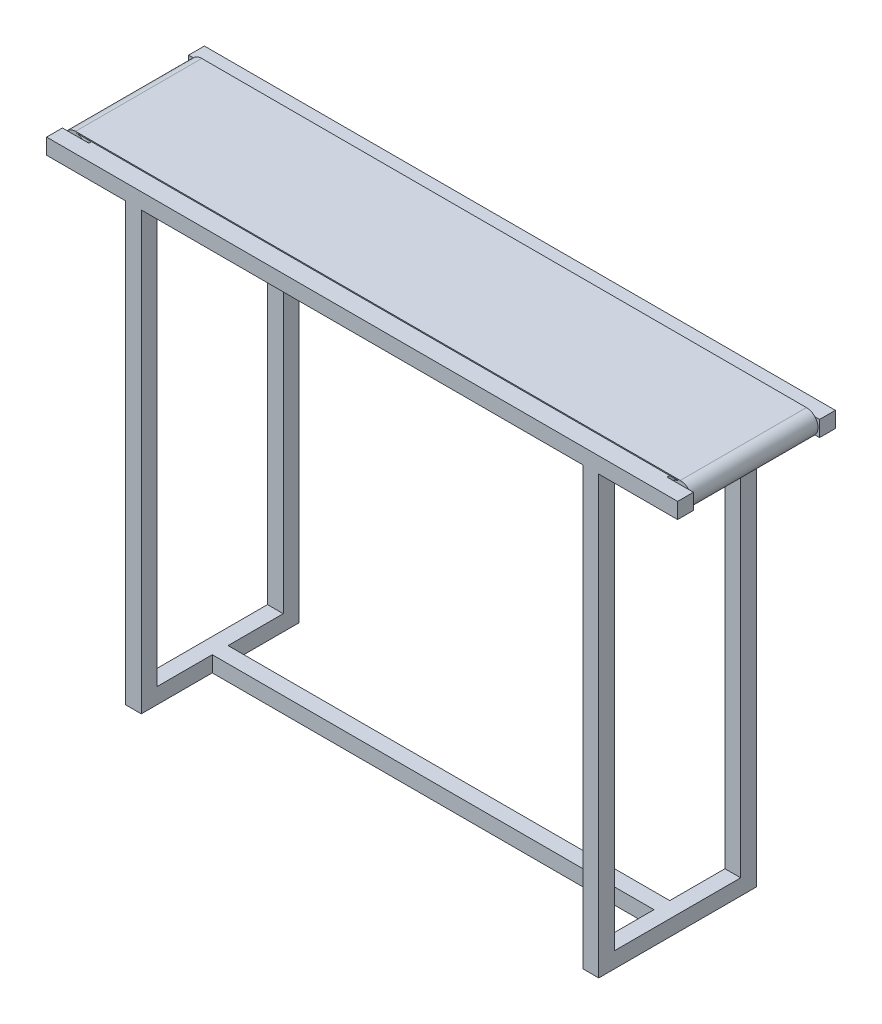
from build123d import *

# Parameters (mm, degrees)
BOSS_EXTRUDE1_DEPTH  = 30
SKETCH2_W            = 30
SKETCH2_H            = 300
BOSS_EXTRUDE2_DEPTH  = 30
SKETCH3_W            = 30
SKETCH3_H            = 30
BOSS_EXTRUDE3_DEPTH  = 800
SKETCH4_W            = 1200
SKETCH4_H            = 30
BOSS_EXTRUDE4_DEPTH  = 30
BOSS_EXTRUDE5_REACH  = 1367.394
SKETCH5_W            = 1100
SKETCH5_H            = 30
BOSS_EXTRUDE6_REACH  = 1350.814
SKETCH6_W            = 30
SKETCH6_H            = 30
SKETCH7_R            = 20
BOSS_EXTRUDE9_DEPTH  = 240
BOSS_EXTRUDE10_START = -240
BOSS_EXTRUDE10_DEPTH = 240
SKETCH9_R            = 6
CUT_EXTRUDE1_DEPTH   = 100


with BuildPart() as part:
    # Sketch1 → Boss-Extrude1 (new body)
    with BuildSketch(Plane.XY):
        Polygon((0, 0), (0, 800), (-150, 800), (-150, 830), (1050, 830), (1050, 800), (900, 800), (900, 0), (870, 0), (870, 800), (30, 800), (30, 0), align=None)
    extrude(amount=BOSS_EXTRUDE1_DEPTH)

    # Sketch2 → Boss-Extrude2 (add)
    with BuildSketch(Plane.XZ):
        with Locations((15, 150)):
            Rectangle(SKETCH2_W, SKETCH2_H)
        with Locations((885, 150)):
            Rectangle(SKETCH2_W, SKETCH2_H)
    extrude(amount=BOSS_EXTRUDE2_DEPTH)

    # Sketch3 → Boss-Extrude3 (add)
    with BuildSketch(Plane(origin=(0, 0, 0), x_dir=(1, 0, 0), z_dir=(0, 1, 0))):
        with Locations((15, -285)):
            Rectangle(SKETCH3_W, SKETCH3_H)
        with Locations((885, -285)):
            Rectangle(SKETCH3_W, SKETCH3_H)
    extrude(amount=BOSS_EXTRUDE3_DEPTH)

    # Sketch4 → Boss-Extrude4 (add)
    with BuildSketch(Plane(origin=(0, 800, 0), x_dir=(1, 0, 0), z_dir=(0, 1, 0))):
        with Locations((450, -285)):
            Rectangle(SKETCH4_W, SKETCH4_H)
    extrude(amount=BOSS_EXTRUDE4_DEPTH)

    # Sketch5 → Boss-Extrude5 (add, up to next)
    with BuildSketch(Plane.XY.offset(30), mode=Mode.PRIVATE) as boss_extrude5_sk1:
        with Locations((450, 815)):
            Rectangle(SKETCH5_W, SKETCH5_H)
    boss_extrude5_tool1 = extrude(boss_extrude5_sk1.sketch, amount=BOSS_EXTRUDE5_REACH, mode=Mode.PRIVATE) - part.part
    add(boss_extrude5_tool1.solids().sort_by_distance((450, 815, 30))[0])

    # Sketch6 → Boss-Extrude6 (add, up to next)
    with BuildSketch(Plane(origin=(30, 0, 0), x_dir=(0, 0, -1), z_dir=(1, 0, 0)), mode=Mode.PRIVATE) as boss_extrude6_sk1:
        with Locations((-150, -15)):
            Rectangle(SKETCH6_W, SKETCH6_H)
    boss_extrude6_tool1 = extrude(boss_extrude6_sk1.sketch, amount=BOSS_EXTRUDE6_REACH, mode=Mode.PRIVATE) - part.part
    add(boss_extrude6_tool1.solids().sort_by_distance((30, -15, 150))[0])

    # Sketch7 → Boss-Extrude9 (add)
    with BuildSketch(Plane(origin=(0, 0, 270), x_dir=(-1, 0, 0), z_dir=(0, 0, -1))):
        with Locations(Location((-1025, 815, 0), (0, 0, 228.590377891))):
            Circle(SKETCH7_R)
        with Locations(Location((125, 815, 0), (0, 0, 228.590377891))):
            Circle(SKETCH7_R)
    extrude(amount=BOSS_EXTRUDE9_DEPTH)

    # Sketch8 → Boss-Extrude10 (add)
    with BuildSketch(Plane(origin=(0, 0, 30), x_dir=(-1, 0, 0), z_dir=(0, 0, -1)).offset(BOSS_EXTRUDE10_START)):
        with BuildLine():
            Line((125, 837), (-1025, 837))
            ThreePointArc((-1025, 837), (-1047, 815), (-1025, 793))
            Line((-1025, 793), (125, 793))
            ThreePointArc((125, 793), (147, 815), (125, 837))
        make_face()
        with BuildLine():
            Line((125, 835), (-1025, 835))
            ThreePointArc((-1025, 835), (-1045, 815), (-1025, 795))
            Line((-1025, 795), (125, 795))
            ThreePointArc((125, 795), (145, 815), (125, 835))
        make_face(mode=Mode.SUBTRACT)
    extrude(amount=BOSS_EXTRUDE10_DEPTH)

    # Sketch9 → Cut-Extrude1 (cut)
    with BuildSketch(Plane.XZ.offset(30)):
        with Locations((15, 280)):
            Circle(SKETCH9_R)
        with Locations(Location((15, 20, 0), (0, 0, 180))):
            Circle(SKETCH9_R)
        with Locations((885, 20)):
            Circle(SKETCH9_R)
        with Locations(Location((885, 280, 0), (0, 0, 180))):
            Circle(SKETCH9_R)
    extrude(amount=-CUT_EXTRUDE1_DEPTH, mode=Mode.SUBTRACT)


solid = part.part
